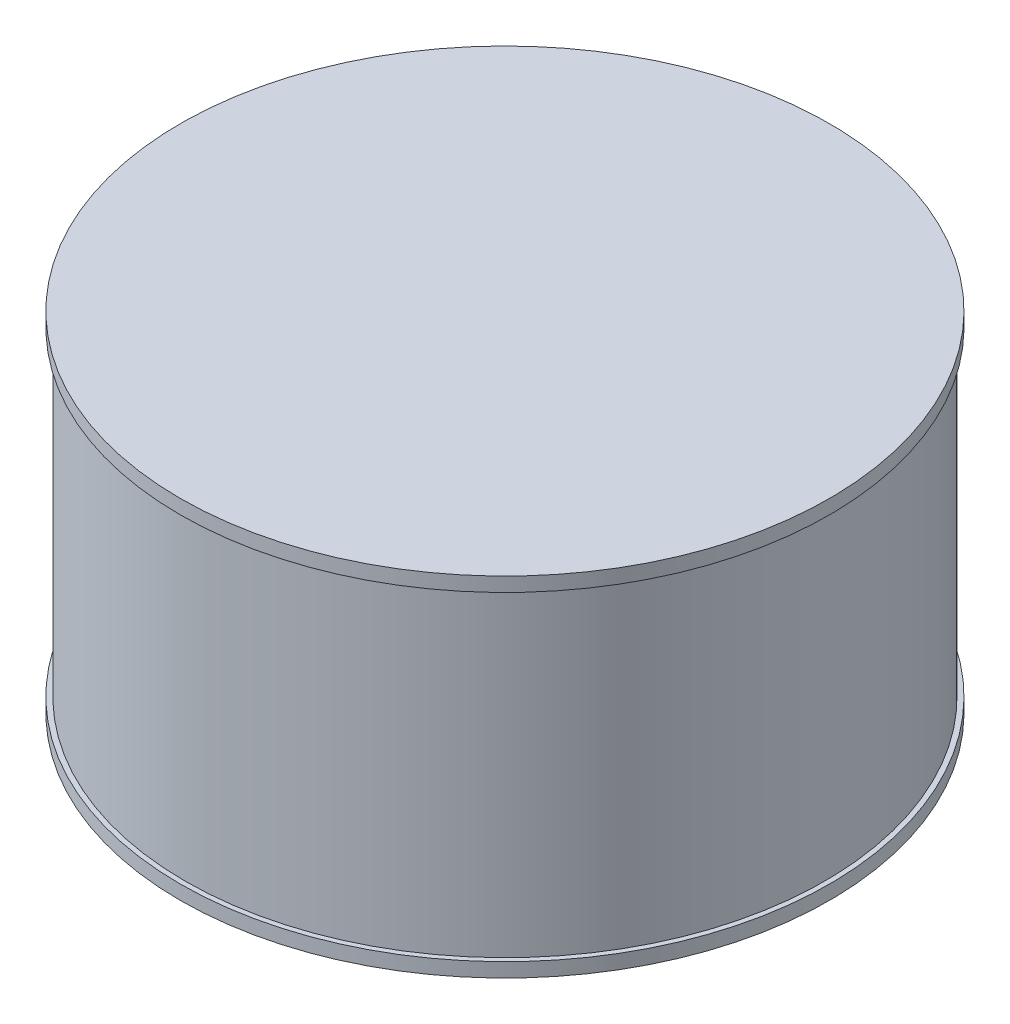
from build123d import *

# Parameters (mm, degrees)
SKETCH1_R           = 45
BOSS_EXTRUDE1_DEPTH = 22.5
SKETCH2_R           = 45.69
BOSS_EXTRUDE2_DEPTH = 2


with BuildPart() as part:
    # Sketch1 → Boss-Extrude1 (new, symmetric)
    with BuildSketch(Plane(origin=(0, 0, 0), x_dir=(1, 0, 0), z_dir=(0, 1, 0))):
        with Locations(Location((0, 0, 0), (0, 0, 90))):
            Circle(SKETCH1_R)
    extrude(amount=BOSS_EXTRUDE1_DEPTH, both=True)

    # Sketch2 → Boss-Extrude2 (add)
    with BuildSketch(Plane(origin=(0, 22.5, 0), x_dir=(1, 0, 0), z_dir=(0, 1, 0))):
        with Locations(Location((0, 0, 0), (0, 0, 270))):
            Circle(SKETCH2_R)
    boss_extrude2 = extrude(amount=BOSS_EXTRUDE2_DEPTH)

    # Mirror1: Boss-Extrude2 across plane
    add(boss_extrude2.mirror(Plane.ZX))


solid = part.part
